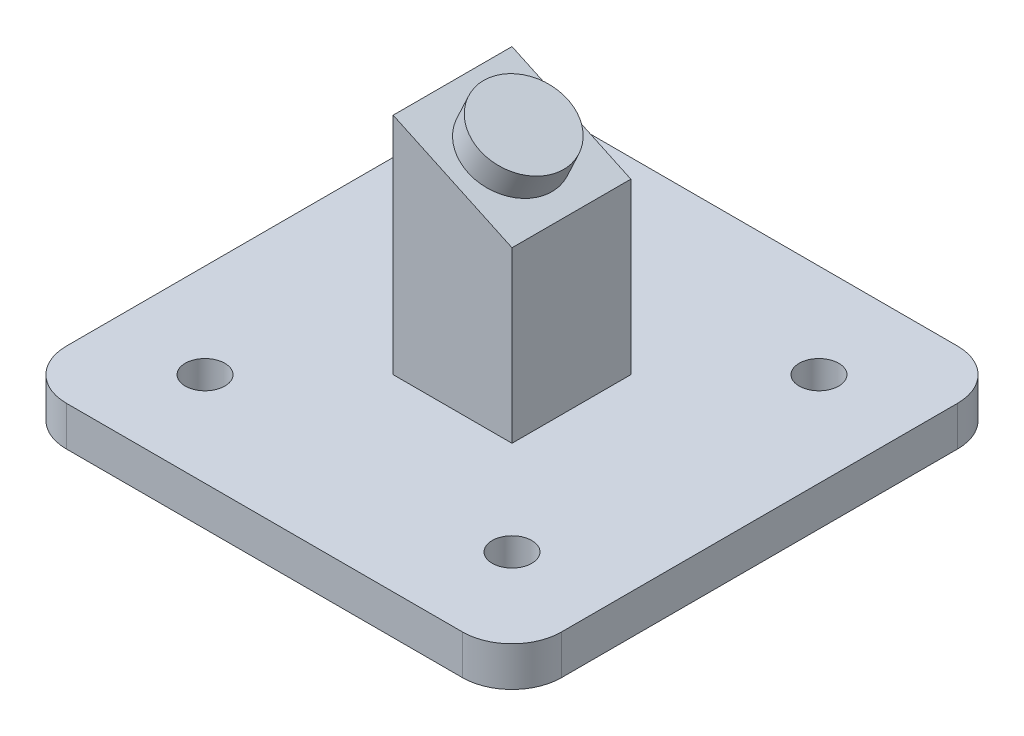
from build123d import *

# Parameters (mm, degrees)
SKETCH1_R           = 2
BOSS_EXTRUDE1_DEPTH = 4
SKETCH3_W           = 12
SKETCH3_H           = 12
BOSS_EXTRUDE3_DEPTH = 17.1
BOSS_EXTRUDE4_DEPTH = 12
SKETCH6_R           = 4.45
BOSS_EXTRUDE5_DEPTH = 2.8


with BuildPart() as part:
    # Sketch1 → Boss-Extrude1 (new body)
    with BuildSketch(Plane(origin=(0, 0, 0), x_dir=(1, 0, 0), z_dir=(0, 1, 0))):
        with BuildLine():
            Line((5, 0), (45, 0))
            ThreePointArc((45, 0), (48.535533906, 1.464466094), (50, 5))
            Line((50, 5), (50, 45))
            ThreePointArc((50, 45), (48.535533906, 48.535533906), (45, 50))
            Line((45, 50), (5, 50))
            ThreePointArc((5, 50), (1.464466094, 48.535533906), (0, 45))
            Line((0, 45), (0, 5))
            ThreePointArc((0, 5), (1.464466094, 1.464466094), (5, 0))
        make_face()
        with Locations(Location((9.5, 9.5, 0), (0, 0, 270))):
            Circle(SKETCH1_R, mode=Mode.SUBTRACT)
        with Locations(Location((9.5, 40.5, 0), (0, 0, 270))):
            Circle(SKETCH1_R, mode=Mode.SUBTRACT)
        with Locations(Location((40.5, 40.5, 0), (0, 0, 270))):
            Circle(SKETCH1_R, mode=Mode.SUBTRACT)
        with Locations(Location((40.5, 9.5, 0), (0, 0, 270))):
            Circle(SKETCH1_R, mode=Mode.SUBTRACT)
    extrude(amount=BOSS_EXTRUDE1_DEPTH)

    # Sketch3 → Boss-Extrude3 (add)
    with BuildSketch(Plane(origin=(0, 4, 0), x_dir=(1, 0, 0), z_dir=(0, 1, 0))):
        with Locations((25, 25)):
            Rectangle(SKETCH3_W, SKETCH3_H)
    extrude(amount=BOSS_EXTRUDE3_DEPTH)

    # Sketch5 → Boss-Extrude4 (add)
    with BuildSketch(Plane.XY.offset(-19)):
        Polygon((31, 21.1), (19, 26.695691898), (19, 21.1), align=None)
    extrude(amount=-BOSS_EXTRUDE4_DEPTH)

    # Sketch6 → Boss-Extrude5 (add)
    with BuildSketch(Plane(origin=(13.618560925, 29.205098151, 0), x_dir=(0.9063077870366527, -0.42261826174069395, 0), z_dir=(0.42261826174069395, 0.9063077870366527, 0))):
        with Locations(Location((12.558028562, 25, 0), (0, 0, 180))):
            Circle(SKETCH6_R)
    extrude(amount=BOSS_EXTRUDE5_DEPTH)


solid = part.part
